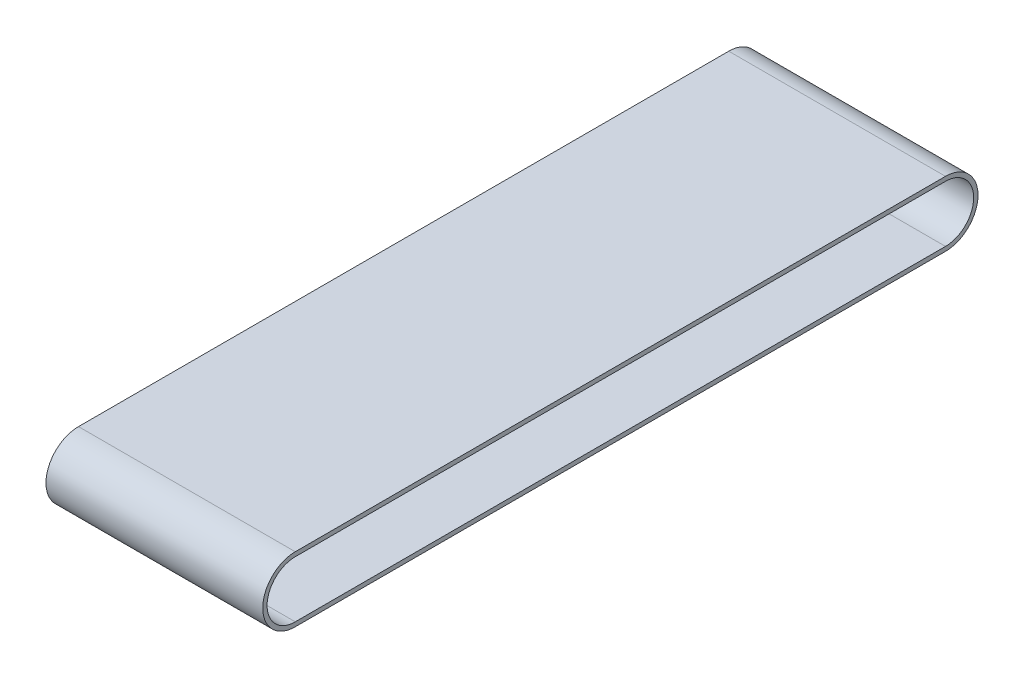
from build123d import *

# Parameters (mm, degrees)
BOSS_EXTRUDE1_DEPTH = 100


with BuildPart() as part:
    # Sketch1 → Boss-Extrude1 (new body)
    with BuildSketch(Plane(origin=(0, 0, 0), x_dir=(0, 0, -1), z_dir=(1, 0, 0))):
        with BuildLine():
            Line((-183.678713125, 37.848101266), (116.321286875, 37.848101266))
            ThreePointArc((116.321286875, 37.848101266), (131.321286875, 22.848101266), (116.321286875, 7.848101266))
            Line((116.321286875, 7.848101266), (-183.678713125, 7.848101266))
            ThreePointArc((-183.678713125, 7.848101266), (-198.678713125, 22.848101266), (-183.678713125, 37.848101266))
        make_face()
        with BuildLine():
            Line((-183.678713125, 9.848101266), (116.321286875, 9.848101266))
            ThreePointArc((116.321286875, 9.848101266), (129.321286875, 22.848101266), (116.321286875, 35.848101266))
            Line((116.321286875, 35.848101266), (-183.678713125, 35.848101266))
            ThreePointArc((-183.678713125, 35.848101266), (-196.678713125, 22.848101266), (-183.678713125, 9.848101266))
        make_face(mode=Mode.SUBTRACT)
    extrude(amount=BOSS_EXTRUDE1_DEPTH)


solid = part.part
